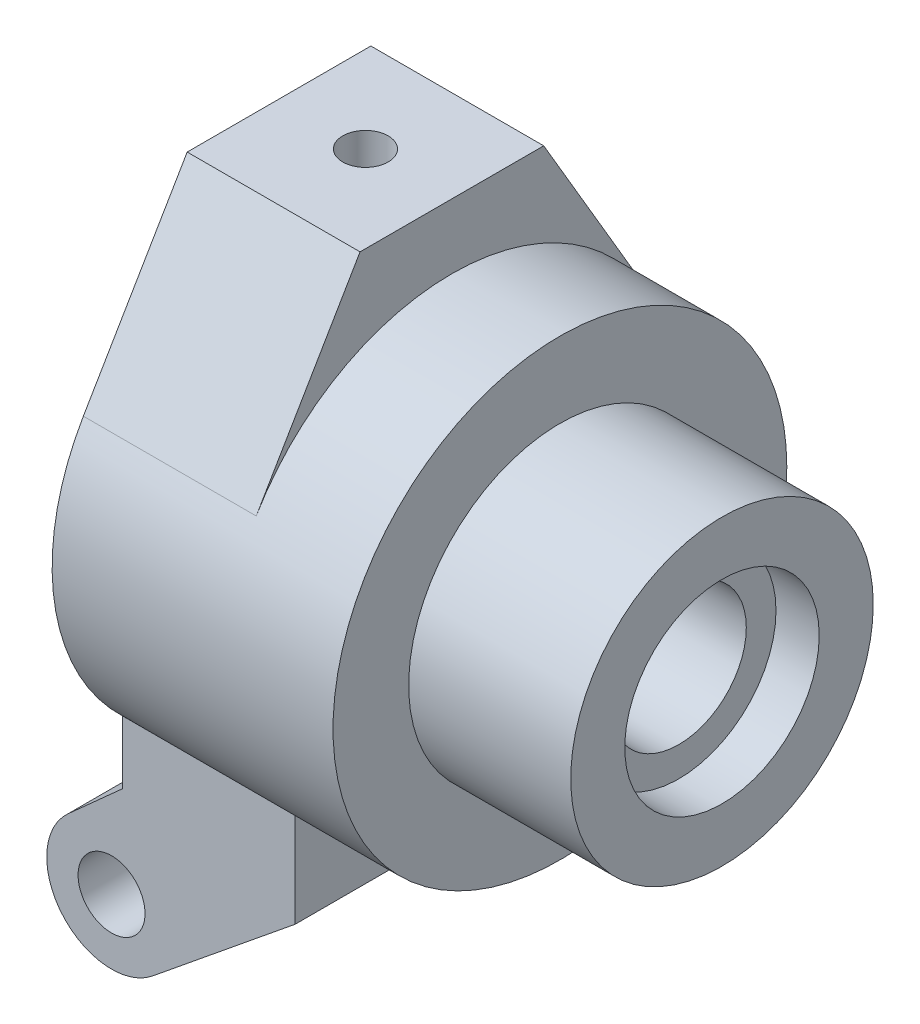
from build123d import *

# Parameters (mm, degrees)
SKETCH_1_R               = 21
EXTRUDE_1_DEPTH          = 26
SKETCH_2_R               = 14
EXTRUDE_2_DEPTH          = 15
EXTRUDE_3_DEPTH          = 16
SKETCH_5_R               = 3.1
EXTRUDE_4_DEPTH          = 14.5
SKETCH_6_R               = 17
CUT_EXTRUDE_2_DEPTH      = 16
SKETCH_7_R               = 9
CUT_EXTRUDE_3_DEPTH      = 4
SKETCH_8_R               = 6.25
CUT_EXTRUDE_4_DEPTH      = 50.658836072
CUT_EXTRUDE_START        = -4
SKETCH_9_R               = 9
CUT_EXTRUDE_5_DEPTH      = 4
CUT_EXTRUDE_6_REACH      = 80.045
CUT_EXTRUDE_6_END_RADIUS = 17
SKETCH_10_R              = 1.75
HOLE_WIZARD_M5_1_REACH   = 76.155
HOLE_WIZARD_M5_1_BORE_R  = 2.1


with BuildPart() as part:
    # 草图1 → 凸台-拉伸1 (new body)
    with BuildSketch(Plane(origin=(0, 0, 0), x_dir=(0, 0, -1), z_dir=(1, 0, 0))):
        with Locations(Location((0, 0, 0), (0, 0, 180))):
            Circle(SKETCH_1_R)
    extrude(amount=EXTRUDE_1_DEPTH)

    # 草图2 → 凸台-拉伸2 (add)
    with BuildSketch(Plane(origin=(26, 0, 0), x_dir=(0, 0, -1), z_dir=(1, 0, 0))):
        Circle(SKETCH_2_R)
    extrude(amount=EXTRUDE_2_DEPTH)

    # 草图4 → 凸台-拉伸3 (add)
    with BuildSketch(Plane.ZY):
        with BuildLine():
            Line((0, 27), (-8.5, 27))
            Line((-8.5, 27), (-18.109583017, 10.63216831))
            ThreePointArc((-18.109583017, 10.63216831), (-10.433706568, 18.224647246), (0, 21))
            Line((0, 21), (0, 27))
        make_face()
        with BuildLine():
            Line((8.5, 27), (0, 27))
            Line((0, 27), (0, 21))
            ThreePointArc((0, 21), (10.433706568, 18.224647246), (18.109583017, 10.63216831))
            Line((18.109583017, 10.63216831), (8.5, 27))
        make_face()
    extrude(amount=-EXTRUDE_3_DEPTH)

    # 草图5 → 凸台-拉伸4 (add, symmetric)
    with BuildSketch(Plane.XY):
        with BuildLine():
            Line((16, -14), (0, -14))
            Line((0, -14), (0, -21.041445119))
            Line((0, -21.041445119), (-5.007077172, -25.534204154))
            ThreePointArc((-5.007077172, -25.534204154), (-6.479163396, -27.554847963), (-7, -30))
            ThreePointArc((-7, -30), (-3.575969226, -35.418891265), (2.788127515, -34.652965713))
            Line((2.788127515, -34.652965713), (16, -23.896759721))
            Line((16, -23.896759721), (16, -14))
        make_face()
        with Locations(Location((-1, -30, 0), (0, 0, 180))):
            Circle(SKETCH_5_R, mode=Mode.SUBTRACT)
    extrude(amount=EXTRUDE_4_DEPTH, both=True)

    # 草图6 → 切除-拉伸2 (cut)
    with BuildSketch(Plane.ZY):
        Circle(SKETCH_6_R)
    extrude(amount=-CUT_EXTRUDE_2_DEPTH, mode=Mode.SUBTRACT)

    # 草图7 → 切除-拉伸3 (cut)
    with BuildSketch(Plane.ZY.offset(-16)):
        Circle(SKETCH_7_R)
    extrude(amount=-CUT_EXTRUDE_3_DEPTH, mode=Mode.SUBTRACT)

    # 草图8 → 切除-拉伸4 (cut, through all)
    with BuildSketch(Plane.ZY.offset(-20)):
        Circle(SKETCH_8_R)
    extrude(amount=-CUT_EXTRUDE_4_DEPTH, mode=Mode.SUBTRACT)

    # 草图9 → 切除-拉伸5 (cut)
    with BuildSketch(Plane(origin=(41, 0, 0), x_dir=(0, 0, -1), z_dir=(1, 0, 0)).offset(CUT_EXTRUDE_START)):
        with Locations(Location((0, 0, 0), (0, 0, 180))):
            Circle(SKETCH_9_R)
    extrude(amount=CUT_EXTRUDE_5_DEPTH, mode=Mode.SUBTRACT)

    # 切除-拉伸6: up to this cylinder (the profile starts outside it)
    cut_extrude_6_end = Plane(origin=(8, 0, 0), z_dir=(-1, 0, 0)) * Cylinder(CUT_EXTRUDE_6_END_RADIUS, 195.09, mode=Mode.PRIVATE)
    # 草图10 → 切除-拉伸6 (cut, up to the surface)
    with BuildSketch(Plane(origin=(0, 27, 0), x_dir=(1, 0, 0), z_dir=(0, 1, 0)), mode=Mode.PRIVATE) as cut_extrude_6_sk1:
        with Locations(Location((8, 0, 0), (0, 0, 270))):
            Circle(SKETCH_10_R)
    cut_extrude_6_tool1 = extrude(cut_extrude_6_sk1.sketch, amount=-CUT_EXTRUDE_6_REACH, mode=Mode.PRIVATE) - cut_extrude_6_end
    add(cut_extrude_6_tool1.solids().sort_by_distance((8, 27, 0))[0], mode=Mode.SUBTRACT)

    # M5 螺纹孔1 bore (on position points) → M5 螺纹孔1 (cut, up to next)
    with BuildSketch(Plane(origin=(8, 27, 0), x_dir=(0, 0, 1), z_dir=(0, 1, 0)), mode=Mode.PRIVATE) as hole_wizard_m5_1_sk1:
        Circle(HOLE_WIZARD_M5_1_BORE_R)
    hole_wizard_m5_1_tool1 = extrude(hole_wizard_m5_1_sk1.sketch, amount=-HOLE_WIZARD_M5_1_REACH, mode=Mode.PRIVATE) & part.part
    add(hole_wizard_m5_1_tool1.solids().sort_by_distance((8, 27, 0))[0], mode=Mode.SUBTRACT)


solid = part.part
